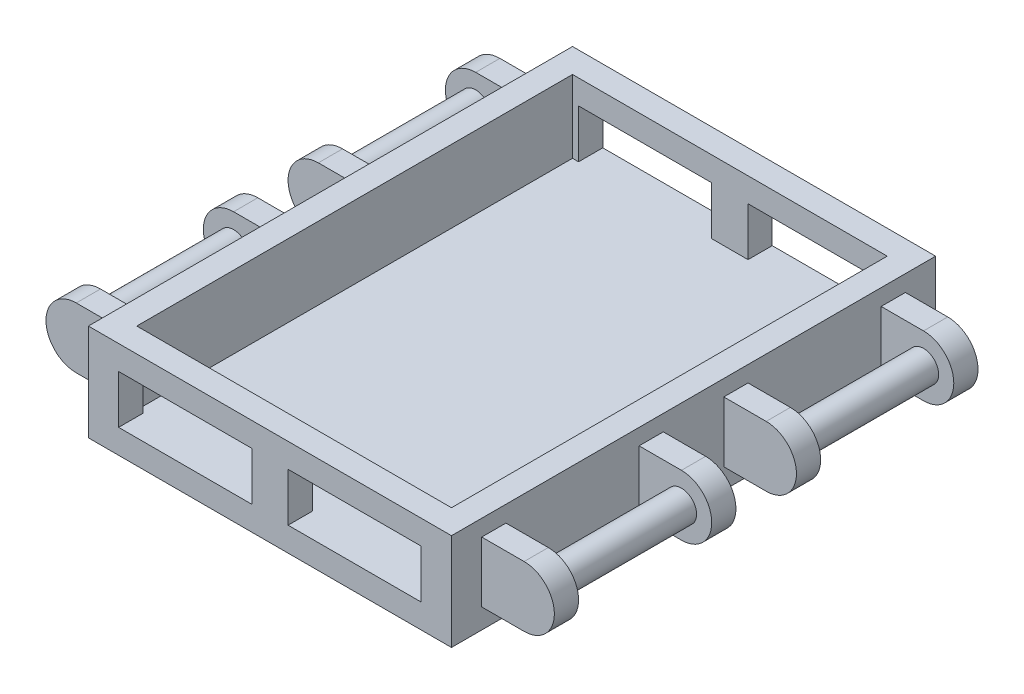
from build123d import *

# Parameters (mm, degrees)
SKETCH2_W                   = 60
SKETCH2_H                   = 80
BOSS_EXTRUDE2_DEPTH         = 16
SKETCH6_W                   = 52
SKETCH6_H                   = 72
CUT_EXTRUDE1_DEPTH          = 12
CUT_EXTRUDE2_DEPTH          = 16
CUT_EXTRUDE2_DEPTH_BACK     = 106
SKETCH7_W                   = 22
SKETCH7_H                   = 8
SKETCH8_W                   = 4
SKETCH8_H                   = 10
BOSS_EXTRUDE3_DEPTH         = 12
FILLET1_RADIUS              = 5
FILLET1_LENGTH              = 4
FILLET2_RADIUS              = 5
FILLET2_LENGTH              = 4
FILLET3_RADIUS              = 5
FILLET3_LENGTH              = 4
FILLET4_RADIUS              = 5
FILLET4_LENGTH              = 4
BOSS_EXTRUDE4_START         = -2
SKETCH9_R                   = 2.5
BOSS_EXTRUDE4_DEPTH         = 26
MIRROR2_START               = -2
MIRROR2_COPY_1_SKETCH_R     = 2.5
MIRROR2_COPY_1_DEPTH        = 26
FILLET1_OF_MIRROR2_2_RADIUS = 5
FILLET1_OF_MIRROR2_2_LENGTH = 4
FILLET2_OF_MIRROR2_2_RADIUS = 5
FILLET2_OF_MIRROR2_2_LENGTH = 4
FILLET3_OF_MIRROR2_2_RADIUS = 5
FILLET3_OF_MIRROR2_2_LENGTH = 4
FILLET4_OF_MIRROR2_2_RADIUS = 5
FILLET4_OF_MIRROR2_2_LENGTH = 4


with BuildPart() as part:
    # Sketch2 → Boss-Extrude2 (new body)
    with BuildSketch(Plane(origin=(0, 0, 0), x_dir=(1, 0, 0), z_dir=(0, 1, 0))):
        Rectangle(SKETCH2_W, SKETCH2_H)
    extrude(amount=BOSS_EXTRUDE2_DEPTH)

    # Sketch6 → Cut-Extrude1 (cut)
    with BuildSketch(Plane(origin=(0, 16, 0), x_dir=(1, 0, 0), z_dir=(0, 1, 0))):
        Rectangle(SKETCH6_W, SKETCH6_H)
    extrude(amount=-CUT_EXTRUDE1_DEPTH, mode=Mode.SUBTRACT)

    # Sketch7 → Cut-Extrude2 (cut, two sides: drawn at the far end of the back side and taken through both)
    with BuildSketch(Plane(origin=(0, 0, -40), x_dir=(-1, 0, 0), z_dir=(0, 0, -1)).offset(-CUT_EXTRUDE2_DEPTH_BACK)):
        with Locations((-14, 8)):
            Rectangle(SKETCH7_W, SKETCH7_H)
        with Locations((14, 8)):
            Rectangle(SKETCH7_W, SKETCH7_H)
    extrude(amount=CUT_EXTRUDE2_DEPTH + CUT_EXTRUDE2_DEPTH_BACK, mode=Mode.SUBTRACT)

    # Sketch8 → Boss-Extrude3 (add)
    with BuildSketch(Plane(origin=(30, 0, 0), x_dir=(0, 0, -1), z_dir=(1, 0, 0))):
        with Locations((-33, 8.303078398)):
            Rectangle(SKETCH8_W, SKETCH8_H)
        with Locations((-7, 8.355173675)):
            Rectangle(SKETCH8_W, SKETCH8_H)
        with Locations((7, 8.355173675)):
            Rectangle(SKETCH8_W, SKETCH8_H)
        with Locations((33, 8.303078398)):
            Rectangle(SKETCH8_W, SKETCH8_H)
    boss_extrude3 = extrude(amount=BOSS_EXTRUDE3_DEPTH)

    # Fillet1: full round fillet: the end face becomes a half cylinder, R = half its width
    fillet1_face = Plane((42, 8.303078398, 33), x_dir=(0, 0, 1), z_dir=(1, 0, 0))  # on the end face: x along it, z out of the body
    fillet1_slab = fillet1_face.offset(-FILLET1_RADIUS / 2) * Box(FILLET1_LENGTH, 2 * FILLET1_RADIUS, FILLET1_RADIUS, mode=Mode.PRIVATE)  # the body's end, R deep
    fillet1_round = Plane((37, 8.303078398, 33), x_dir=(1, 0, 0), z_dir=(0, 0, 1)) * Cylinder(FILLET1_RADIUS, FILLET1_LENGTH, mode=Mode.PRIVATE)  # its axis R under the face
    add(fillet1_slab - fillet1_round, mode=Mode.SUBTRACT)

    # Fillet2: full round fillet: the end face becomes a half cylinder, R = half its width
    fillet2_face = Plane((42, 8.355173675, 7), x_dir=(0, 0, 1), z_dir=(1, 0, 0))  # on the end face: x along it, z out of the body
    fillet2_slab = fillet2_face.offset(-FILLET2_RADIUS / 2) * Box(FILLET2_LENGTH, 2 * FILLET2_RADIUS, FILLET2_RADIUS, mode=Mode.PRIVATE)  # the body's end, R deep
    fillet2_round = Plane((37, 8.355173675, 7), x_dir=(1, 0, 0), z_dir=(0, 0, 1)) * Cylinder(FILLET2_RADIUS, FILLET2_LENGTH, mode=Mode.PRIVATE)  # its axis R under the face
    add(fillet2_slab - fillet2_round, mode=Mode.SUBTRACT)

    # Fillet3: full round fillet: the end face becomes a half cylinder, R = half its width
    fillet3_face = Plane((42, 8.355173675, -7), x_dir=(0, 0, -1), z_dir=(1, 0, 0))  # on the end face: x along it, z out of the body
    fillet3_slab = fillet3_face.offset(-FILLET3_RADIUS / 2) * Box(FILLET3_LENGTH, 2 * FILLET3_RADIUS, FILLET3_RADIUS, mode=Mode.PRIVATE)  # the body's end, R deep
    fillet3_round = Plane((37, 8.355173675, -7), x_dir=(1, 0, 0), z_dir=(0, 0, -1)) * Cylinder(FILLET3_RADIUS, FILLET3_LENGTH, mode=Mode.PRIVATE)  # its axis R under the face
    add(fillet3_slab - fillet3_round, mode=Mode.SUBTRACT)

    # Fillet4: full round fillet: the end face becomes a half cylinder, R = half its width
    fillet4_face = Plane((42, 8.303078398, -33), x_dir=(0, 0, -1), z_dir=(1, 0, 0))  # on the end face: x along it, z out of the body
    fillet4_slab = fillet4_face.offset(-FILLET4_RADIUS / 2) * Box(FILLET4_LENGTH, 2 * FILLET4_RADIUS, FILLET4_RADIUS, mode=Mode.PRIVATE)  # the body's end, R deep
    fillet4_round = Plane((37, 8.303078398, -33), x_dir=(1, 0, 0), z_dir=(0, 0, -1)) * Cylinder(FILLET4_RADIUS, FILLET4_LENGTH, mode=Mode.PRIVATE)  # its axis R under the face
    add(fillet4_slab - fillet4_round, mode=Mode.SUBTRACT)

    # Sketch9 → Boss-Extrude4 (add)
    with BuildSketch(Plane(origin=(0, 0, 31), x_dir=(-1, 0, 0), z_dir=(0, 0, -1)).offset(BOSS_EXTRUDE4_START)):
        with Locations(Location((-37, 8.303078398, 0), (0, 0, 180))):
            Circle(SKETCH9_R)
    boss_extrude4 = extrude(amount=BOSS_EXTRUDE4_DEPTH)

    # Mirror1: Boss-Extrude4 across plane
    add(boss_extrude4.mirror(Plane(origin=(0, 0, 0), x_dir=(1, 0, 0), z_dir=(0, 0, -1))))

    # Mirror2: Boss-Extrude3, Boss-Extrude4 across plane
    add(boss_extrude3.mirror(Plane(origin=(0, 0, 0), x_dir=(0, 0, 1), z_dir=(1, 0, 0))))
    add(boss_extrude4.mirror(Plane(origin=(0, 0, 0), x_dir=(0, 0, 1), z_dir=(1, 0, 0))))

    # Mirror2 copy 1 sketch → Mirror2 copy 1 (add)
    with BuildSketch(Plane.XY.offset(-31).offset(MIRROR2_START)):
        with Locations(Location((-37, 8.303078398, 0), (0, 0, 180))):
            Circle(MIRROR2_COPY_1_SKETCH_R)
    extrude(amount=MIRROR2_COPY_1_DEPTH)

    # Fillet1 of Mirror2 2: full round fillet: the end face becomes a half cylinder, R = half its width
    fillet1_of_mirror2_2_face = Plane((-42, 8.303078398, 33), x_dir=(0, 0, 1), z_dir=(-1, 0, 0))  # on the end face: x along it, z out of the body
    fillet1_of_mirror2_2_slab = fillet1_of_mirror2_2_face.offset(-FILLET1_OF_MIRROR2_2_RADIUS / 2) * Box(FILLET1_OF_MIRROR2_2_LENGTH, 2 * FILLET1_OF_MIRROR2_2_RADIUS, FILLET1_OF_MIRROR2_2_RADIUS, mode=Mode.PRIVATE)  # the body's end, R deep
    fillet1_of_mirror2_2_round = Plane((-37, 8.303078398, 33), x_dir=(-1, 0, 0), z_dir=(0, 0, 1)) * Cylinder(FILLET1_OF_MIRROR2_2_RADIUS, FILLET1_OF_MIRROR2_2_LENGTH, mode=Mode.PRIVATE)  # its axis R under the face
    add(fillet1_of_mirror2_2_slab - fillet1_of_mirror2_2_round, mode=Mode.SUBTRACT)

    # Fillet2 of Mirror2 2: full round fillet: the end face becomes a half cylinder, R = half its width
    fillet2_of_mirror2_2_face = Plane((-42, 8.355173675, 7), x_dir=(0, 0, 1), z_dir=(-1, 0, 0))  # on the end face: x along it, z out of the body
    fillet2_of_mirror2_2_slab = fillet2_of_mirror2_2_face.offset(-FILLET2_OF_MIRROR2_2_RADIUS / 2) * Box(FILLET2_OF_MIRROR2_2_LENGTH, 2 * FILLET2_OF_MIRROR2_2_RADIUS, FILLET2_OF_MIRROR2_2_RADIUS, mode=Mode.PRIVATE)  # the body's end, R deep
    fillet2_of_mirror2_2_round = Plane((-37, 8.355173675, 7), x_dir=(-1, 0, 0), z_dir=(0, 0, 1)) * Cylinder(FILLET2_OF_MIRROR2_2_RADIUS, FILLET2_OF_MIRROR2_2_LENGTH, mode=Mode.PRIVATE)  # its axis R under the face
    add(fillet2_of_mirror2_2_slab - fillet2_of_mirror2_2_round, mode=Mode.SUBTRACT)

    # Fillet3 of Mirror2 2: full round fillet: the end face becomes a half cylinder, R = half its width
    fillet3_of_mirror2_2_face = Plane((-42, 8.355173675, -7), x_dir=(0, 0, -1), z_dir=(-1, 0, 0))  # on the end face: x along it, z out of the body
    fillet3_of_mirror2_2_slab = fillet3_of_mirror2_2_face.offset(-FILLET3_OF_MIRROR2_2_RADIUS / 2) * Box(FILLET3_OF_MIRROR2_2_LENGTH, 2 * FILLET3_OF_MIRROR2_2_RADIUS, FILLET3_OF_MIRROR2_2_RADIUS, mode=Mode.PRIVATE)  # the body's end, R deep
    fillet3_of_mirror2_2_round = Plane((-37, 8.355173675, -7), x_dir=(-1, 0, 0), z_dir=(0, 0, -1)) * Cylinder(FILLET3_OF_MIRROR2_2_RADIUS, FILLET3_OF_MIRROR2_2_LENGTH, mode=Mode.PRIVATE)  # its axis R under the face
    add(fillet3_of_mirror2_2_slab - fillet3_of_mirror2_2_round, mode=Mode.SUBTRACT)

    # Fillet4 of Mirror2 2: full round fillet: the end face becomes a half cylinder, R = half its width
    fillet4_of_mirror2_2_face = Plane((-42, 8.303078398, -33), x_dir=(0, 0, -1), z_dir=(-1, 0, 0))  # on the end face: x along it, z out of the body
    fillet4_of_mirror2_2_slab = fillet4_of_mirror2_2_face.offset(-FILLET4_OF_MIRROR2_2_RADIUS / 2) * Box(FILLET4_OF_MIRROR2_2_LENGTH, 2 * FILLET4_OF_MIRROR2_2_RADIUS, FILLET4_OF_MIRROR2_2_RADIUS, mode=Mode.PRIVATE)  # the body's end, R deep
    fillet4_of_mirror2_2_round = Plane((-37, 8.303078398, -33), x_dir=(-1, 0, 0), z_dir=(0, 0, -1)) * Cylinder(FILLET4_OF_MIRROR2_2_RADIUS, FILLET4_OF_MIRROR2_2_LENGTH, mode=Mode.PRIVATE)  # its axis R under the face
    add(fillet4_of_mirror2_2_slab - fillet4_of_mirror2_2_round, mode=Mode.SUBTRACT)


solid = part.part
